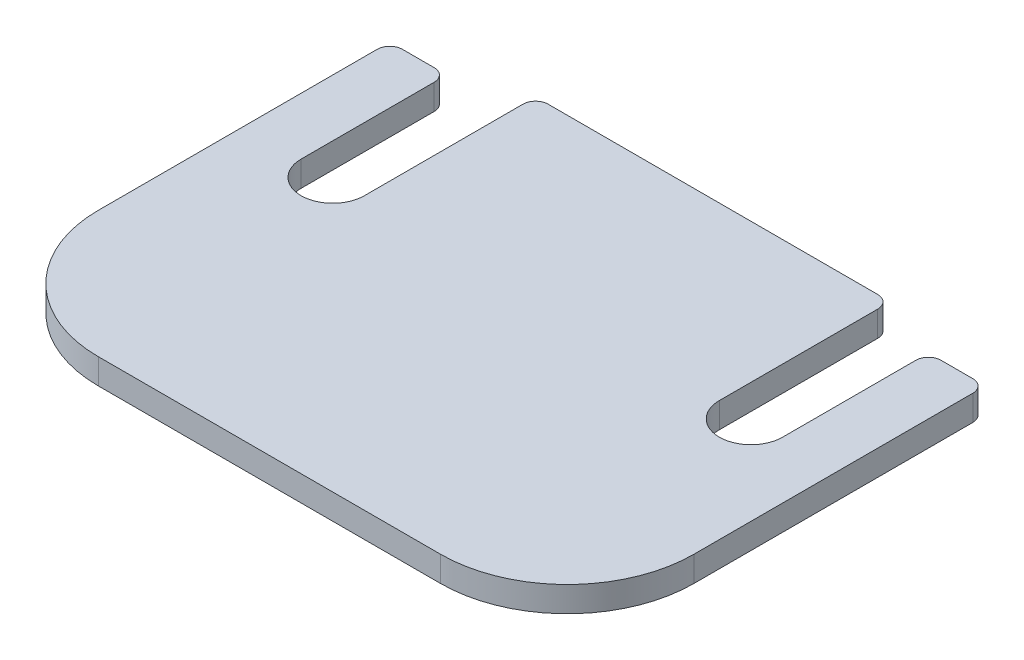
from build123d import *

# Parameters (mm, degrees)
RESSALTO_EXTRUS_O1_DEPTH = 2


with BuildPart() as part:
    # Esboço1 → Ressalto-extrusão1 (new body)
    with BuildSketch(Plane(origin=(0, 0, 0), x_dir=(1, 0, 0), z_dir=(0, 1, 0))):
        with BuildLine():
            Line((-23.5, 14.5), (-23.5, -7.5))
            ThreePointArc((-23.5, -7.5), (-20.571067812, -14.571067812), (-13.5, -17.5))
            Line((-13.5, -17.5), (13.5, -17.5))
            ThreePointArc((13.5, -17.5), (20.571067812, -14.571067812), (23.5, -7.5))
            Line((23.5, -7.5), (23.5, 14.5))
            ThreePointArc((23.5, 14.5), (23.207106781, 15.207106781), (22.5, 15.5))
            Line((22.5, 15.5), (20, 15.5))
            ThreePointArc((20, 15.5), (19.292893219, 15.207106781), (19, 14.5))
            Line((19, 14.5), (19, 4))
            ThreePointArc((19, 4), (16.5, 1.5), (14, 4))
            Line((14, 4), (14, 16.5))
            ThreePointArc((14, 16.5), (13.707106781, 17.207106781), (13, 17.5))
            Line((13, 17.5), (-13, 17.5))
            ThreePointArc((-13, 17.5), (-13.707106781, 17.207106781), (-14, 16.5))
            Line((-14, 16.5), (-14, 4))
            ThreePointArc((-14, 4), (-16.5, 1.5), (-19, 4))
            Line((-19, 4), (-19, 14.5))
            ThreePointArc((-19, 14.5), (-19.292893219, 15.207106781), (-20, 15.5))
            Line((-20, 15.5), (-22.5, 15.5))
            ThreePointArc((-22.5, 15.5), (-23.207106781, 15.207106781), (-23.5, 14.5))
        make_face()
    extrude(amount=RESSALTO_EXTRUS_O1_DEPTH)


solid = part.part
